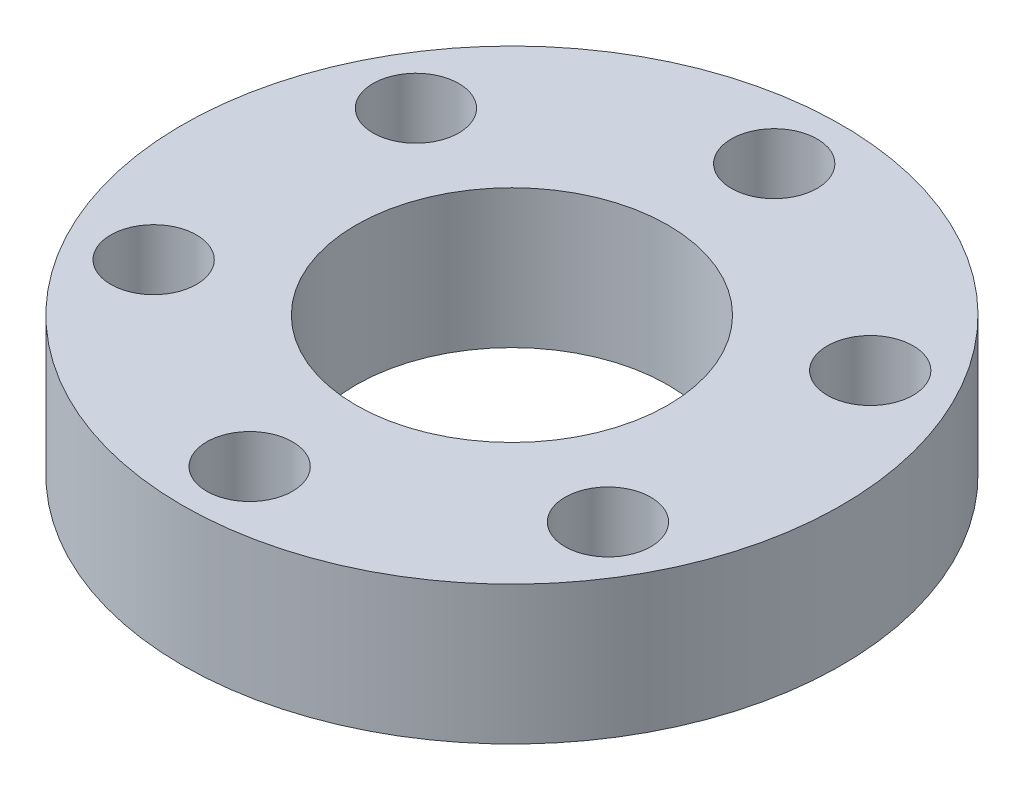
from build123d import *

# Parameters (mm, degrees)
SKETCH_1_R      = 16.9
SKETCH_1_R_2    = 8
SKETCH_1_R_3    = 2.2
EXTRUDE_1_DEPTH = 7.1


with BuildPart() as part:
    # 草图1 → 凸台-拉伸1 (new body)
    with BuildSketch(Plane(origin=(0, 0, 0), x_dir=(1, 0, 0), z_dir=(0, 1, 0))):
        with Locations(Location((0, 0, 0), (0, 0, 270))):
            Circle(SKETCH_1_R)
        with Locations(Location((0, 0, 0), (0, 0, 270))):
            Circle(SKETCH_1_R_2, mode=Mode.SUBTRACT)
        with Locations(Location((0, 13.45, 0), (0, 0, 270))):
            Circle(SKETCH_1_R_3, mode=Mode.SUBTRACT)
        with Locations(Location((11.648041681, 6.725, 0), (0, 0, 270))):
            Circle(SKETCH_1_R_3, mode=Mode.SUBTRACT)
        with Locations(Location((11.648041681, -6.725, 0), (0, 0, 270))):
            Circle(SKETCH_1_R_3, mode=Mode.SUBTRACT)
        with Locations(Location((0, -13.45, 0), (0, 0, 270))):
            Circle(SKETCH_1_R_3, mode=Mode.SUBTRACT)
        with Locations(Location((-11.648041681, -6.725, 0), (0, 0, 270))):
            Circle(SKETCH_1_R_3, mode=Mode.SUBTRACT)
        with Locations(Location((-11.648041681, 6.725, 0), (0, 0, 270))):
            Circle(SKETCH_1_R_3, mode=Mode.SUBTRACT)
    extrude(amount=EXTRUDE_1_DEPTH)


solid = part.part
